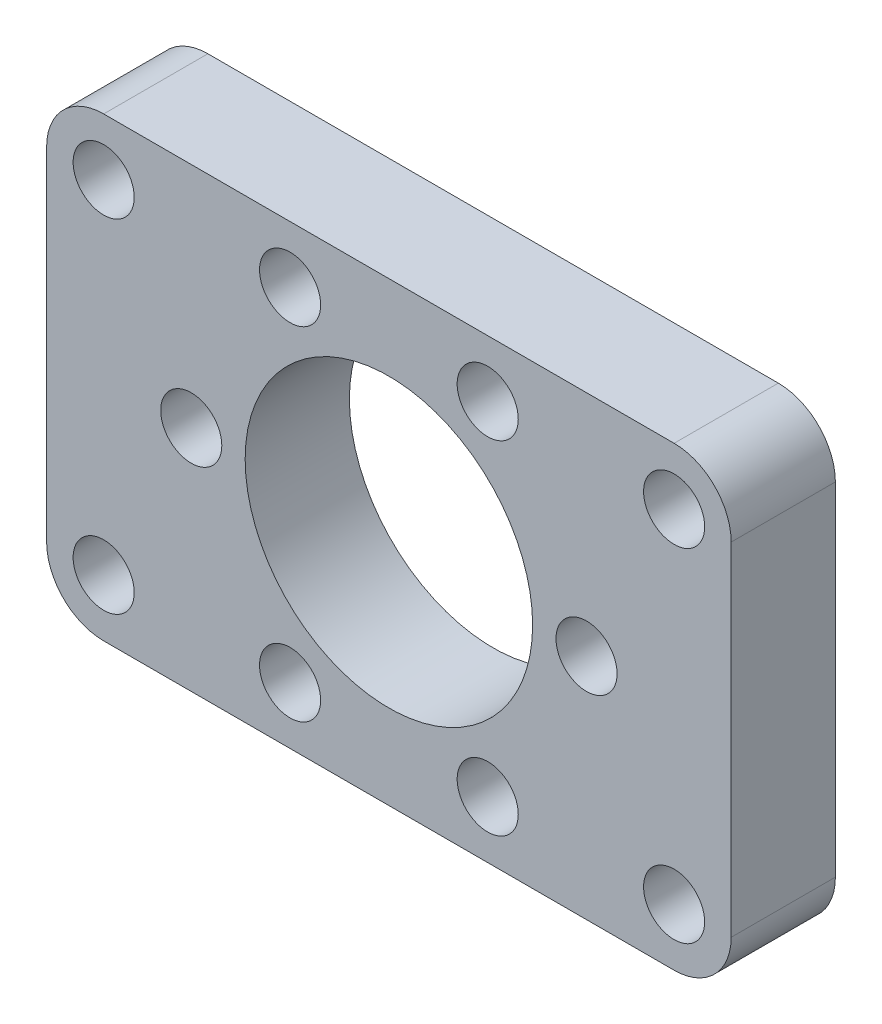
from build123d import *

# Parameters (mm, degrees)
SKETCH1_W                = 38.1
SKETCH1_H                = 25.4
BOSS_EXTRUDE1_DEPTH      = 5.8
SKETCH2_R                = 8
CUT_EXTRUDE1_DEPTH       = 47.156364675
M3_CLEARANCE_HOLE1_D     = 3.4
M3_CLEARANCE_HOLE1_DEPTH = 6.35
M3_CLEARANCE_HOLE1_TIP   = 1.021463052
M3_CLEARANCE_HOLE2_D     = 3.4
M3_CLEARANCE_HOLE2_DEPTH = 6.35
M3_CLEARANCE_HOLE2_TIP   = 1.021463052
FILLET1_R                = 3.175


with BuildPart() as part:
    # Sketch1 → Boss-Extrude1 (new body)
    with BuildSketch(Plane.XY):
        with Locations((19.05, 12.7)):
            Rectangle(SKETCH1_W, SKETCH1_H)
    extrude(amount=BOSS_EXTRUDE1_DEPTH)

    # Sketch2 → Cut-Extrude1 (cut, through all)
    with BuildSketch(Plane.XY.offset(5.8)):
        with Locations((19.05, 12.7)):
            Circle(SKETCH2_R)
    extrude(amount=-CUT_EXTRUDE1_DEPTH, mode=Mode.SUBTRACT)

    # M3 Clearance Hole1
    with Locations(Plane.XY.offset(5.8)):
        with Locations((30.05, 12.7), (24.55, 22.226279442), (13.55, 22.226279442), (8.05, 12.7), (13.55, 3.173720558), (24.55, 3.173720558)):
            Hole(M3_CLEARANCE_HOLE1_D / 2, depth=M3_CLEARANCE_HOLE1_DEPTH)
            with Locations((0, 0, -(M3_CLEARANCE_HOLE1_DEPTH + M3_CLEARANCE_HOLE1_TIP / 2))):  # 118° drill point
                Cone(0, M3_CLEARANCE_HOLE1_D / 2, M3_CLEARANCE_HOLE1_TIP, mode=Mode.SUBTRACT)

    # M3 Clearance Hole2
    with Locations(Plane.XY.offset(5.8)):
        with Locations((3.175, 22.225), (34.925, 22.225), (34.925, 3.175), (3.175, 3.175)):
            Hole(M3_CLEARANCE_HOLE2_D / 2, depth=M3_CLEARANCE_HOLE2_DEPTH)
            with Locations((0, 0, -(M3_CLEARANCE_HOLE2_DEPTH + M3_CLEARANCE_HOLE2_TIP / 2))):  # 118° drill point
                Cone(0, M3_CLEARANCE_HOLE2_D / 2, M3_CLEARANCE_HOLE2_TIP, mode=Mode.SUBTRACT)

    # Fillet1
    fillet1_edges = [part.edges().sort_by_distance(p)[0] for p in [
        (0, 25.4, 2.9),
        (38.1, 25.4, 2.9),
        (38.1, 0, 2.9),
        (0, 0, 2.9),
    ]]
    fillet(fillet1_edges, radius=FILLET1_R)


solid = part.part
